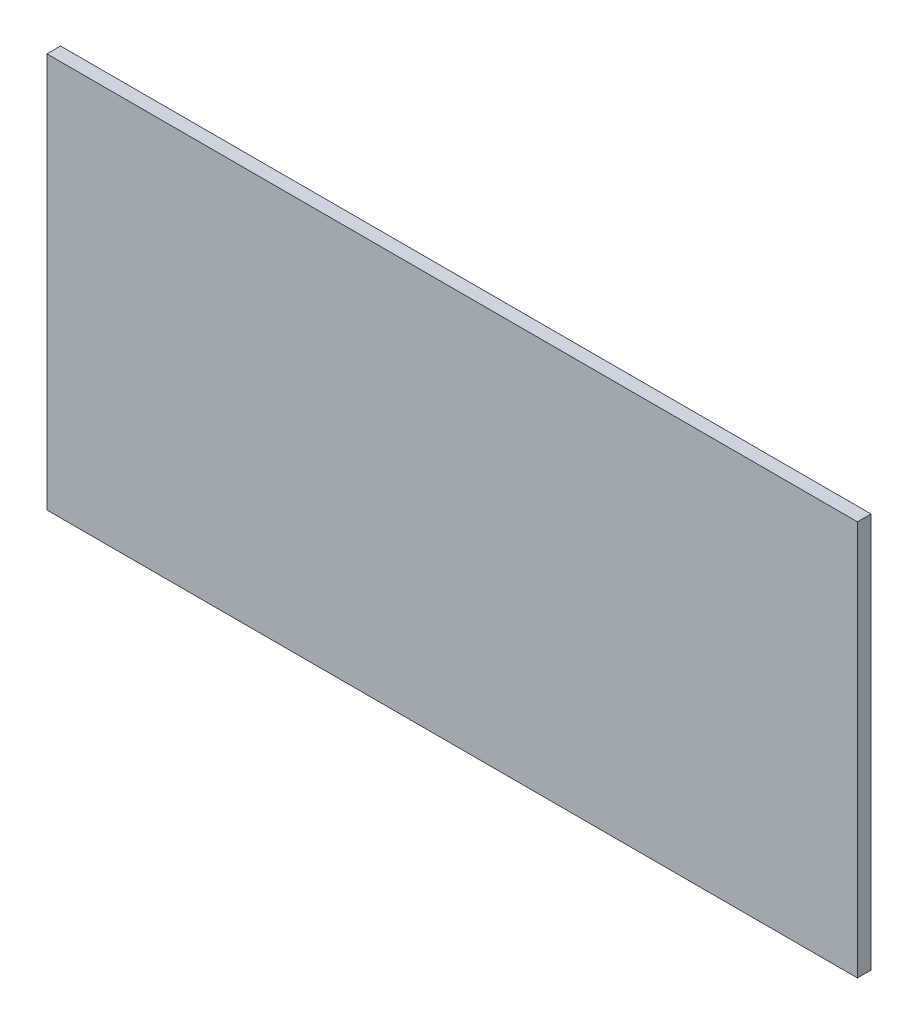
from build123d import *

# Parameters (mm, degrees)
SKETCH_1_W      = 595
SKETCH_1_H      = 290
EXTRUDE_1_DEPTH = 10


with BuildPart() as part:
    # Эскиз1 → Бобышка-Вытянуть1 (new body)
    with BuildSketch(Plane.XY):
        Rectangle(SKETCH_1_W, SKETCH_1_H)
    extrude(amount=EXTRUDE_1_DEPTH)


solid = part.part
